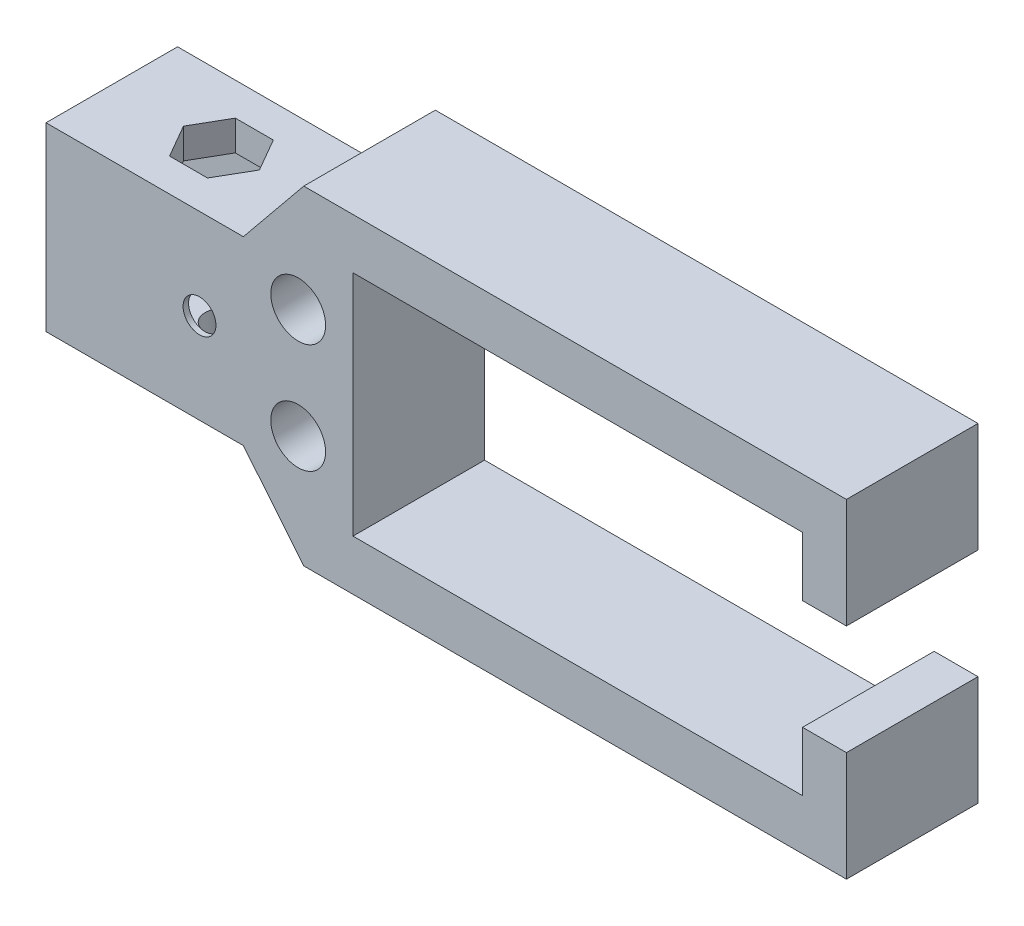
from build123d import *

# Parameters (mm, degrees)
SKETCH_2_W           = 30.5
SKETCH_2_H           = 20.5
SKETCH_2_W_2         = 22.5
SKETCH_2_H_2         = 12.5
EXTRUDE_1_DEPTH      = 12
SKETCH_3_W           = 2.75
SKETCH_3_H           = 10
EXTRUDE_2_DEPTH      = 3
SKETCH_4_W           = 4.940698383
SKETCH_4_H           = 10
CUT_EXTRUDE_1_DEPTH  = 9
EXTRUDE_3_DEPTH      = 20
EXTRUDE_4_REACH      = 38.805
SKETCH_7_R           = 1.252665059
CUT_EXTRUDE_2_DEPTH  = 41.374032496
SKETCH_8_W           = 10
SKETCH_8_H           = 10
CUT_EXTRUDE_3_DEPTH  = 18
SKETCH_10_W          = 23.106147985
SKETCH_10_H          = 7.754593222
CUT_EXTRUDE_4_DEPTH  = 42.146840705
SKETCH_11_R          = 1.5
CUT_EXTRUDE_5_DEPTH  = 44.934610502
CUT_EXTRUDE_6_REACH  = 60.181
SKETCH_12_W          = 11
SKETCH_12_H          = 11
SKETCH_13_W          = 23.5
SKETCH_13_H          = 13.5
CUT_EXTRUDE_7_DEPTH  = 42.146840705
SKETCH_14_W          = 9.129424231
SKETCH_14_H          = 10.218893611
CUT_EXTRUDE_8_DEPTH  = 42.146840705
SKETCH_15_W          = 55
SKETCH_15_H          = 30
EXTRUDE_5_DEPTH      = 12
CUT_EXTRUDE_9_DEPTH  = 43.579337712
SKETCH_18_R          = 2.5
CUT_EXTRUDE_10_DEPTH = 43.579337712
CUT_EXTRUDE_11_DEPTH = 43.579337712
CUT_EXTRUDE_12_REACH = 48.136
CUT_EXTRUDE_13_REACH = 44.579
SKETCH_21_R          = 1.5


with BuildPart() as part:
    # 草图2 → 凸台-拉伸1 (new body)
    with BuildSketch(Plane.XY):
        Rectangle(SKETCH_2_W, SKETCH_2_H)
        Rectangle(SKETCH_2_W_2, SKETCH_2_H_2, mode=Mode.SUBTRACT)
    extrude(amount=EXTRUDE_1_DEPTH)

    # 草图3 → 凸台-拉伸2 (add)
    with BuildSketch(Plane.XY.offset(12)):
        with Locations((-16.625, 0)):
            Rectangle(SKETCH_3_W, SKETCH_3_H)
    extrude_2 = extrude(amount=-EXTRUDE_2_DEPTH)

    # 镜向1: 凸台-拉伸2 across plane
    add(extrude_2.mirror(Plane(origin=(0, 0, 0), x_dir=(0, 0, 1), z_dir=(1, 0, 0))))

    # 草图4 → 切除-拉伸1 (cut)
    with BuildSketch(Plane(origin=(0, 0, 0), x_dir=(-1, 0, 0), z_dir=(0, 0, -1))):
        with Locations((15.220349192, 0)):
            Rectangle(SKETCH_4_W, SKETCH_4_H)
    cut_extrude_1 = extrude(amount=-CUT_EXTRUDE_1_DEPTH, mode=Mode.SUBTRACT)

    # 镜向2: 切除-拉伸1 across plane
    add(cut_extrude_1.mirror(Plane(origin=(0, 0, 0), x_dir=(0, 0, 1), z_dir=(1, 0, 0))), mode=Mode.SUBTRACT)

    # 草图5 → 凸台-拉伸3 (add)
    with BuildSketch(Plane.ZY.offset(18)):
        Polygon((12, 10.25), (12, 5), (12, -5), (12, -10.25), (0, -10.25), (0, -5), (0, 5), (0, 10.25), align=None)
    extrude(amount=EXTRUDE_3_DEPTH)

    # 草图6 → 凸台-拉伸4 (add, up to next)
    with BuildSketch(Plane.ZY.offset(15.25), mode=Mode.PRIVATE) as extrude_4_sk1:
        Polygon((12, -5), (9, -5), (0, -5), (0, -10.25), (12, -10.25), align=None)
    extrude_4_tool1 = extrude(extrude_4_sk1.sketch, amount=EXTRUDE_4_REACH, mode=Mode.PRIVATE) - part.part
    extrude_4 = extrude_4_tool1.solids().sort_by_distance((-15.25, -7.625, 6))[0]
    add(extrude_4)

    # 镜向3: 凸台-拉伸4 across plane
    add(extrude_4.mirror(Plane.ZX))

    # 草图7 → 切除-拉伸2 (cut, through all)
    with BuildSketch(Plane(origin=(0, 0, 9), x_dir=(-1, 0, 0), z_dir=(0, 0, -1))):
        with Locations((15.487865972, 2.296552608)):
            Circle(SKETCH_7_R)
    cut_extrude_2 = extrude(amount=-CUT_EXTRUDE_2_DEPTH, mode=Mode.SUBTRACT)

    # 草图8 → 切除-拉伸3 (cut)
    with BuildSketch(Plane.ZY.offset(38)):
        with Locations((6, 0)):
            Rectangle(SKETCH_8_W, SKETCH_8_H)
    extrude(amount=-CUT_EXTRUDE_3_DEPTH, mode=Mode.SUBTRACT)

    # 草图10 → 切除-拉伸4 (cut, through all)
    with BuildSketch(Plane(origin=(0, 0, 0), x_dir=(-1, 0, 0), z_dir=(0, 0, -1))):
        with Locations((31.553073992, 12.127296611)):
            Rectangle(SKETCH_10_W, SKETCH_10_H)
    cut_extrude_4 = extrude(amount=-CUT_EXTRUDE_4_DEPTH, mode=Mode.SUBTRACT)

    # 镜向4: 切除-拉伸4 across plane
    add(cut_extrude_4.mirror(Plane.ZX), mode=Mode.SUBTRACT)

    # 草图11 → 切除-拉伸5 (cut, through all)
    with BuildSketch(Plane.XZ.offset(8.25)):
        with Locations(Location((-28, 6, 0), (0, 0, 270))):
            Circle(SKETCH_11_R)
    extrude(amount=-CUT_EXTRUDE_5_DEPTH, mode=Mode.SUBTRACT)

    # 镜向5: 切除-拉伸2 across plane
    add(cut_extrude_2.mirror(Plane(origin=(0, 0, 0), x_dir=(0, 0, 1), z_dir=(1, 0, 0))), mode=Mode.SUBTRACT)

    # 切除-拉伸6: up to this face of the body (flat: up to its plane)
    cut_extrude_6_end = Plane(part.part.faces().sort_by_distance((-20, 0, 6))[0])
    # 草图12 → 切除-拉伸6 (cut, up to the picked face)
    with BuildSketch(Plane.ZY.offset(38), mode=Mode.PRIVATE) as cut_extrude_6_sk1:
        with Locations((6, 0)):
            Rectangle(SKETCH_12_W, SKETCH_12_H)
    cut_extrude_6_tool1 = split(extrude(cut_extrude_6_sk1.sketch, amount=-CUT_EXTRUDE_6_REACH, mode=Mode.PRIVATE), bisect_by=cut_extrude_6_end, keep=Keep.BOTH, mode=Mode.PRIVATE)
    add(cut_extrude_6_tool1.solids().sort_by(Axis((-38, 0, 6), (1, 0, 0)))[0], mode=Mode.SUBTRACT)

    # 草图13 → 切除-拉伸7 (cut, through all)
    with BuildSketch(Plane.XY.offset(12)):
        Rectangle(SKETCH_13_W, SKETCH_13_H)
    extrude(amount=-CUT_EXTRUDE_7_DEPTH, mode=Mode.SUBTRACT)

    # 草图14 → 切除-拉伸8 (cut, through all)
    with BuildSketch(Plane.XY.offset(12)):
        with Locations((13.435287884, 0.109446806)):
            Rectangle(SKETCH_14_W, SKETCH_14_H)
    extrude(amount=-CUT_EXTRUDE_8_DEPTH, mode=Mode.SUBTRACT)

    # 草图15 → 凸台-拉伸5 (add)
    with BuildSketch(Plane.XY.offset(12)):
        with Locations((7.5, 0)):
            Rectangle(SKETCH_15_W, SKETCH_15_H)
    extrude(amount=-EXTRUDE_5_DEPTH)

    # 草图17 → 切除-拉伸9 (cut, through all)
    with BuildSketch(Plane.XY.offset(12)):
        Polygon((35, -5), (35, 5), (31, 5), (31, 10.4), (-10, 10.4), (-10, -10.4), (31, -10.4), (31, -5), align=None)
    extrude(amount=-CUT_EXTRUDE_9_DEPTH, mode=Mode.SUBTRACT)

    # 草图18 → 切除-拉伸10 (cut, through all)
    with BuildSketch(Plane(origin=(0, 0, 0), x_dir=(-1, 0, 0), z_dir=(0, 0, -1))):
        with Locations((15, -5)):
            Circle(SKETCH_18_R)
    cut_extrude_10 = extrude(amount=-CUT_EXTRUDE_10_DEPTH, mode=Mode.SUBTRACT)

    # 镜向6: 切除-拉伸10 across plane
    add(cut_extrude_10.mirror(Plane.ZX), mode=Mode.SUBTRACT)

    # 草图19 → 切除-拉伸11 (cut, through all)
    with BuildSketch(Plane(origin=(0, 0, 0), x_dir=(-1, 0, 0), z_dir=(0, 0, -1))):
        Polygon((20, 8.25), (14.491422615, 15), (20, 15), align=None)
    cut_extrude_11 = extrude(amount=-CUT_EXTRUDE_11_DEPTH, mode=Mode.SUBTRACT)

    # 镜向7: 切除-拉伸11 across plane
    add(cut_extrude_11.mirror(Plane.ZX), mode=Mode.SUBTRACT)

    # 草图20 → 切除-拉伸12 (cut, up to next)
    with BuildSketch(Plane(origin=(0, 8.25, 0), x_dir=(1, 0, 0), z_dir=(0, 1, 0)), mode=Mode.PRIVATE) as cut_extrude_12_sk1:
        Polygon((-26.267949192, -3), (-29.732050808, -3), (-31.464101615, -6), (-29.732050808, -9), (-26.267949192, -9), (-24.535898385, -6), align=None)
    cut_extrude_12_tool1 = extrude(cut_extrude_12_sk1.sketch, amount=-CUT_EXTRUDE_12_REACH, mode=Mode.PRIVATE) & part.part
    add(cut_extrude_12_tool1.solids().sort_by_distance((-28, 8.25, 6))[0], mode=Mode.SUBTRACT)

    # 草图21 → 切除-拉伸13 (cut, up to next)
    with BuildSketch(Plane.XY.offset(12), mode=Mode.PRIVATE) as cut_extrude_13_sk1:
        with Locations((-24, 0)):
            Circle(SKETCH_21_R)
    cut_extrude_13_tool1 = extrude(cut_extrude_13_sk1.sketch, amount=-CUT_EXTRUDE_13_REACH, mode=Mode.PRIVATE) & part.part
    add(cut_extrude_13_tool1.solids().sort_by_distance((-24, 0, 12))[0], mode=Mode.SUBTRACT)


solid = part.part
